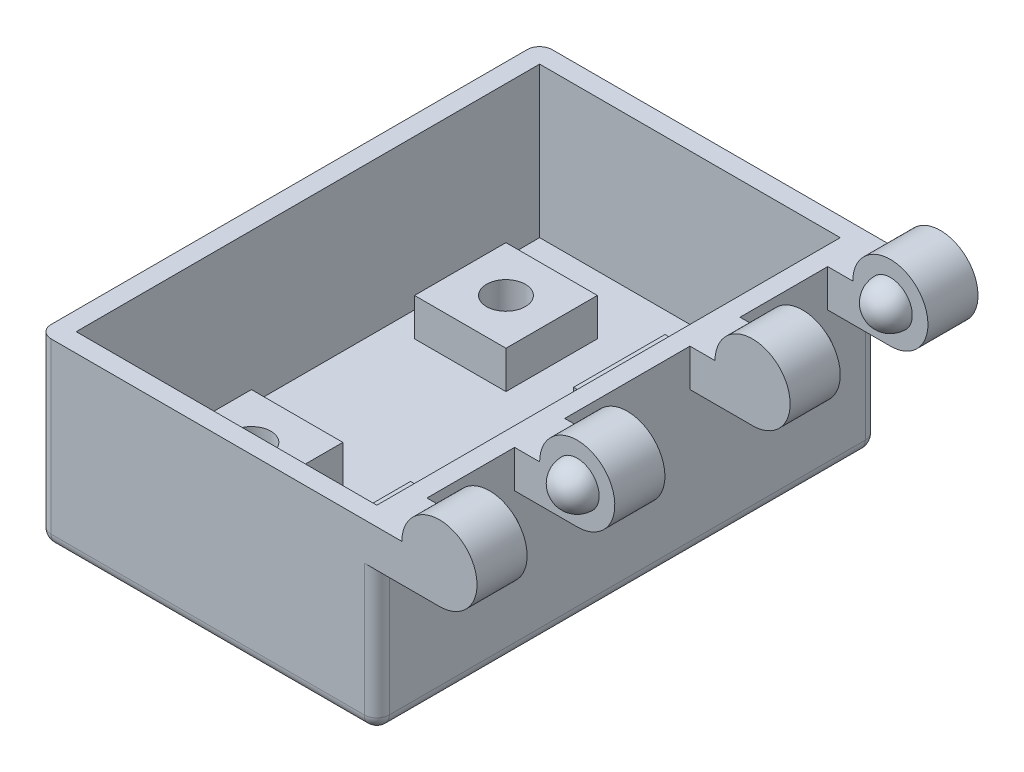
from build123d import *

# Parameters (mm, degrees)
SKETCH2_W                 = 27
SKETCH2_H                 = 40
BOSS_EXTRUDE1_DEPTH       = 2.5
SKETCH3_W                 = 27
SKETCH3_H                 = 40
SKETCH3_W_2               = 24
SKETCH3_H_2               = 37
BOSS_EXTRUDE2_DEPTH       = 12
BOSS_EXTRUDE3_DEPTH       = 4
SKETCH5_W                 = 7.3
SKETCH5_H                 = 7.3
BOSS_EXTRUDE4_DEPTH       = 3
F_3_0MM_DOWEL_HOLE1_D     = 3.1
F_3_0MM_DOWEL_HOLE1_DEPTH = 2.8
F_3_0MM_DOWEL_HOLE1_TIP   = 0.931333959
REVOLVE1_ANGLE            = 180
MIRROR2_COPY_1_DEPTH      = 4
MIRROR2_COPY_2_ANGLE      = 180
FILLET1_R                 = 1


with BuildPart() as part:
    # Sketch2 → Boss-Extrude1 (new body)
    with BuildSketch(Plane(origin=(0, 0, 0), x_dir=(1, 0, 0), z_dir=(0, 1, 0))):
        Rectangle(SKETCH2_W, SKETCH2_H)
    extrude(amount=BOSS_EXTRUDE1_DEPTH)

    # Sketch3 → Boss-Extrude2 (add)
    with BuildSketch(Plane(origin=(0, 2.5, 0), x_dir=(1, 0, 0), z_dir=(0, 1, 0))):
        Rectangle(SKETCH3_W, SKETCH3_H)
        Rectangle(SKETCH3_W_2, SKETCH3_H_2, mode=Mode.SUBTRACT)
    extrude(amount=BOSS_EXTRUDE2_DEPTH)

    # Sketch4 → Boss-Extrude3 (add)
    with BuildSketch(Plane.XY.offset(20)):
        with BuildLine():
            Line((15.5, 14.5), (13.5, 14.5))
            Line((13.5, 14.5), (13.5, 11.5))
            Line((13.5, 11.5), (18.5, 11.5))
            ThreePointArc((18.5, 11.5), (20.621320344, 16.621320344), (15.5, 14.5))
        make_face()
    boss_extrude3 = extrude(amount=-BOSS_EXTRUDE3_DEPTH)

    # Sketch5 → Boss-Extrude4 (add)
    with BuildSketch(Plane(origin=(0, 2.5, 0), x_dir=(1, 0, 0), z_dir=(0, 1, 0))):
        with Locations((-6.35, 10.16)):
            Rectangle(SKETCH5_W, SKETCH5_H)
        with Locations((6.35, 10.16)):
            Rectangle(SKETCH5_W, SKETCH5_H)
        with Locations((6.35, -10.16)):
            Rectangle(SKETCH5_W, SKETCH5_H)
        with Locations((-6.35, -10.16)):
            Rectangle(SKETCH5_W, SKETCH5_H)
    extrude(amount=BOSS_EXTRUDE4_DEPTH)

    # Ø3.0mm Dowel Hole1
    with Locations(Plane(origin=(0, 5.5, 0), x_dir=(1, 0, 0), z_dir=(0, 1, 0))):
        with Locations((-6.35, 10.16), (6.35, 10.16), (6.35, -10.16), (-6.35, -10.16)):
            Hole(F_3_0MM_DOWEL_HOLE1_D / 2, depth=F_3_0MM_DOWEL_HOLE1_DEPTH)
            with Locations((0, 0, -(F_3_0MM_DOWEL_HOLE1_DEPTH + F_3_0MM_DOWEL_HOLE1_TIP / 2))):  # 118° drill point
                Cone(0, F_3_0MM_DOWEL_HOLE1_D / 2, F_3_0MM_DOWEL_HOLE1_TIP, mode=Mode.SUBTRACT)

    # Sketch13 → Revolve1 (revolve)
    with BuildSketch(Plane(origin=(0, 0, 16), x_dir=(-1, 0, 0), z_dir=(0, 0, -1))):
        with BuildLine():
            Line((-18.5, 16.25), (-18.5, 12.75))
            ThreePointArc((-18.5, 12.75), (-16.75, 14.5), (-18.5, 16.25))
        make_face()
    revolve1 = revolve(axis=Axis((18.5, 11.5, 16), (0, -1, 0)), revolution_arc=REVOLVE1_ANGLE)

    # Mirror1: Boss-Extrude3, Revolve1 across plane
    add(boss_extrude3.mirror(Plane(origin=(0, 0, 12.5), x_dir=(1, 0, 0), z_dir=(0, 0, -1))))
    add(revolve1.mirror(Plane(origin=(0, 0, 12.5), x_dir=(1, 0, 0), z_dir=(0, 0, -1))))

    # Mirror2: Boss-Extrude3, Revolve1 across plane
    add(boss_extrude3.mirror(Plane(origin=(0, 0, 0), x_dir=(1, 0, 0), z_dir=(0, 0, -1))))
    add(revolve1.mirror(Plane(origin=(0, 0, 0), x_dir=(1, 0, 0), z_dir=(0, 0, -1))))

    # Mirror2 copy 1 sketch → Mirror2 copy 1 (add)
    with BuildSketch(Plane.XY.offset(-5)):
        with BuildLine():
            Line((15.5, 14.5), (13.5, 14.5))
            Line((13.5, 14.5), (13.5, 11.5))
            Line((13.5, 11.5), (18.5, 11.5))
            ThreePointArc((18.5, 11.5), (20.621320344, 16.621320344), (15.5, 14.5))
        make_face()
    extrude(amount=-MIRROR2_COPY_1_DEPTH)

    # Mirror2 copy 2 sketch → Mirror2 copy 2 (revolve)
    with BuildSketch(Plane(origin=(0, 0, -9), x_dir=(-1, 0, 0), z_dir=(0, 0, -1))):
        with BuildLine():
            Line((-18.5, 16.25), (-18.5, 12.75))
            ThreePointArc((-18.5, 12.75), (-16.75, 14.5), (-18.5, 16.25))
        make_face()
    revolve(axis=Axis((18.5, 11.5, -9), (0, -1, 0)), revolution_arc=MIRROR2_COPY_2_ANGLE)

    # Fillet1
    fillet1_edges = [part.edges().sort_by_distance(p)[0] for p in [
        (13.5, 5.75, -20),
        (13.5, 5.75, 20),
        (0, 0, 20),
        (-13.5, 0, 0),
        (0, 0, -20),
        (13.5, 0, 0),
        (-13.5, 7.25, 20),
        (-13.5, 7.25, -20),
    ]]
    fillet(fillet1_edges, radius=FILLET1_R)


solid = part.part
